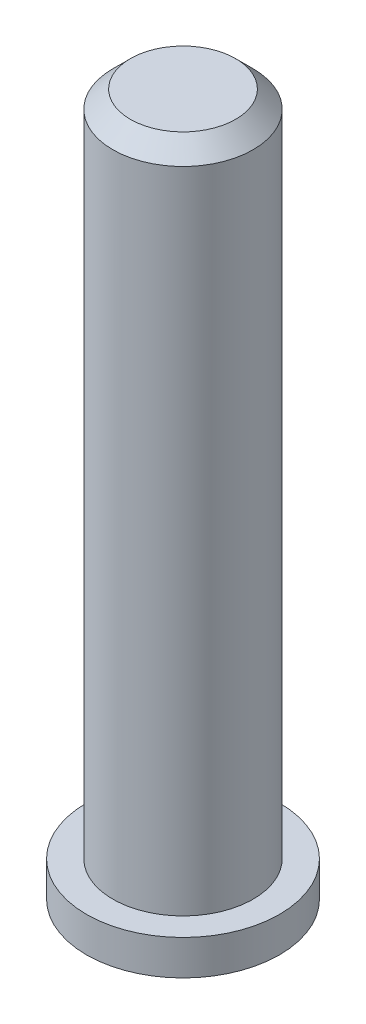
from build123d import *

# Parameters (mm, degrees)
SKETCH_1_R      = 2
EXTRUDE_1_DEPTH = 20
CHAMFER_1_SIZE  = 0.5
SKETCH_2_R      = 2.75
EXTRUDE_2_DEPTH = 1
SKETCH_3_R      = 0.325
EXTRUDE_3_DEPTH = 0.55


with BuildPart() as part:
    # Эскиз1 → Вытянуть1 (new body)
    with BuildSketch(Plane(origin=(0, 0, 0), x_dir=(1, 0, 0), z_dir=(0, 1, 0))):
        with Locations(Location((0, 0, 0), (0, 0, 270))):
            Circle(SKETCH_1_R)
    extrude(amount=EXTRUDE_1_DEPTH)

    # Фаска1
    chamfer_1_edges = [part.edges().sort_by_distance(p)[0] for p in [
        (0, 20, -2),
    ]]
    chamfer(chamfer_1_edges, length=CHAMFER_1_SIZE)

    # Эскиз2 → Вытянуть2 (add)
    with BuildSketch(Plane.XZ):
        with Locations(Location((0, 0, 0), (0, 0, 270))):
            Circle(SKETCH_2_R)
    extrude(amount=-EXTRUDE_2_DEPTH)

    # Эскиз3 → Вытянуть3 (add)
    with BuildSketch(Plane.XZ):
        with Locations(Location((0, 0, 0), (0, 0, 90))):
            Circle(SKETCH_3_R)
    extrude(amount=EXTRUDE_3_DEPTH)


solid = part.part
